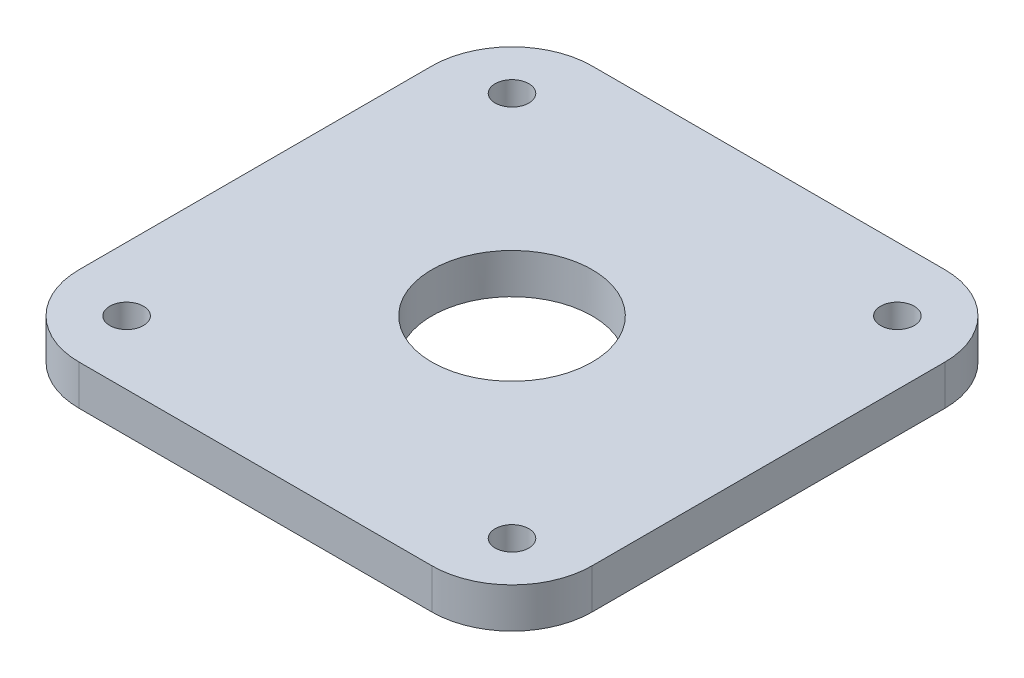
from build123d import *

# Parameters (mm, degrees)
SKETCH_1_W          = 64
SKETCH_1_H          = 64
EXTRUDE_1_DEPTH     = 5
FILLET_1_R          = 10
SKETCH_3_R          = 2.1
CUT_EXTRUDE_2_DEPTH = 10
SKETCH_2_R          = 10
CUT_EXTRUDE_3_DEPTH = 20


with BuildPart() as part:
    # 草图1 → 凸台-拉伸1 (new body)
    with BuildSketch(Plane(origin=(0, 0, 0), x_dir=(1, 0, 0), z_dir=(0, 1, 0))):
        Rectangle(SKETCH_1_W, SKETCH_1_H)
    extrude(amount=EXTRUDE_1_DEPTH)

    # 圆角1
    fillet_1_edges = [part.edges().sort_by_distance(p)[0] for p in [
        (32, 2.5, 32),
        (-32, 2.5, 32),
        (-32, 2.5, -32),
        (32, 2.5, -32),
    ]]
    fillet(fillet_1_edges, radius=FILLET_1_R)

    # 草图3 → 切除-拉伸2 (cut)
    with BuildSketch(Plane(origin=(0, 5, 0), x_dir=(1, 0, 0), z_dir=(0, 1, 0))):
        with Locations(Location((24.04163056, 24.04163056, 0), (0, 0, 270))):
            Circle(SKETCH_3_R)
        with Locations(Location((24.04163056, -24.04163056, 0), (0, 0, 270))):
            Circle(SKETCH_3_R)
        with Locations(Location((-24.04163056, -24.04163056, 0), (0, 0, 270))):
            Circle(SKETCH_3_R)
        with Locations(Location((-24.04163056, 24.04163056, 0), (0, 0, 270))):
            Circle(SKETCH_3_R)
    extrude(amount=-CUT_EXTRUDE_2_DEPTH, mode=Mode.SUBTRACT)

    # 草图2 → 切除-拉伸3 (cut)
    with BuildSketch(Plane(origin=(0, 5, 0), x_dir=(1, 0, 0), z_dir=(0, 1, 0))):
        with Locations(Location((0, 0, 0), (0, 0, 270))):
            Circle(SKETCH_2_R)
    extrude(amount=-CUT_EXTRUDE_3_DEPTH, mode=Mode.SUBTRACT)


solid = part.part
